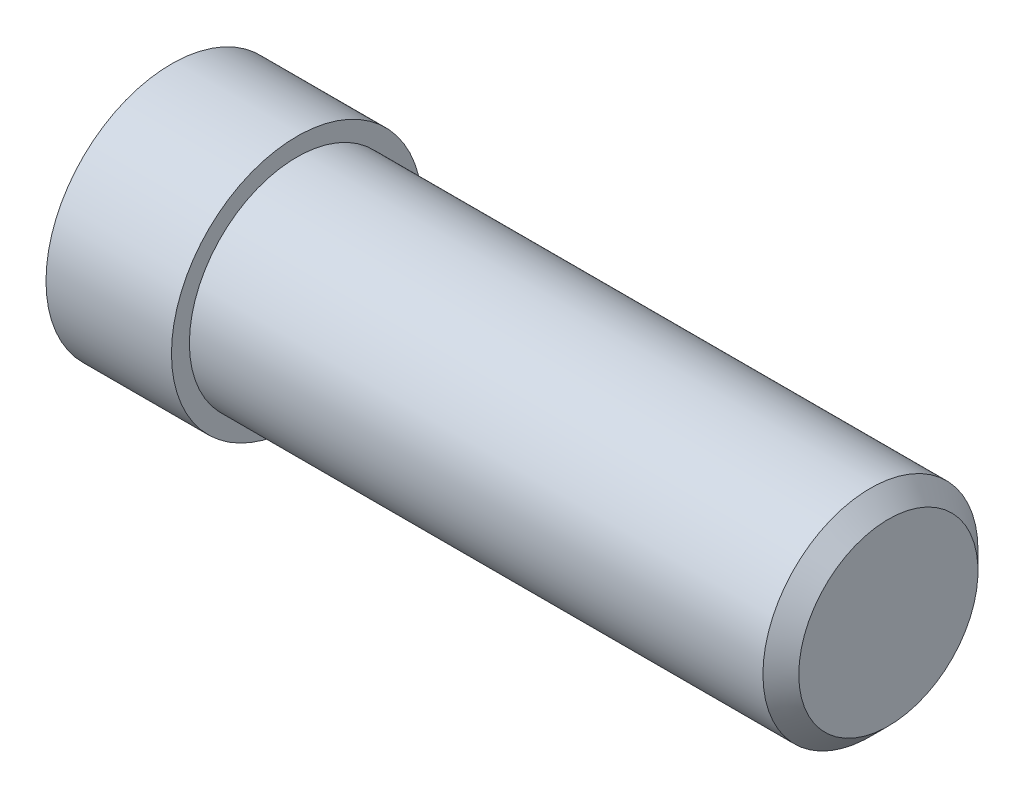
from build123d import *

# Parameters (mm, degrees)
CHAMFER1_SIZE = 1


with BuildPart() as part:
    # Sketch1 → Revolve1 (revolve)
    with BuildSketch(Plane.XY, mode=Mode.PRIVATE) as revolve1_sk:
        Polygon((-20, 0), (-20, 7), (-13, 7), (-13, 6), (20, 6), (20, 0), align=None)
    revolve(revolve1_sk.sketch.rotate(Axis((-33.804878049, 0, 0), (1, 0, 0)), 90), axis=Axis((-33.804878049, 0, 0), (1, 0, 0)))

    # Chamfer1
    chamfer1_edges = [part.edges().sort_by_distance(p)[0] for p in [
        (20, 0, -6),
    ]]
    chamfer(chamfer1_edges, length=CHAMFER1_SIZE)


solid = part.part
